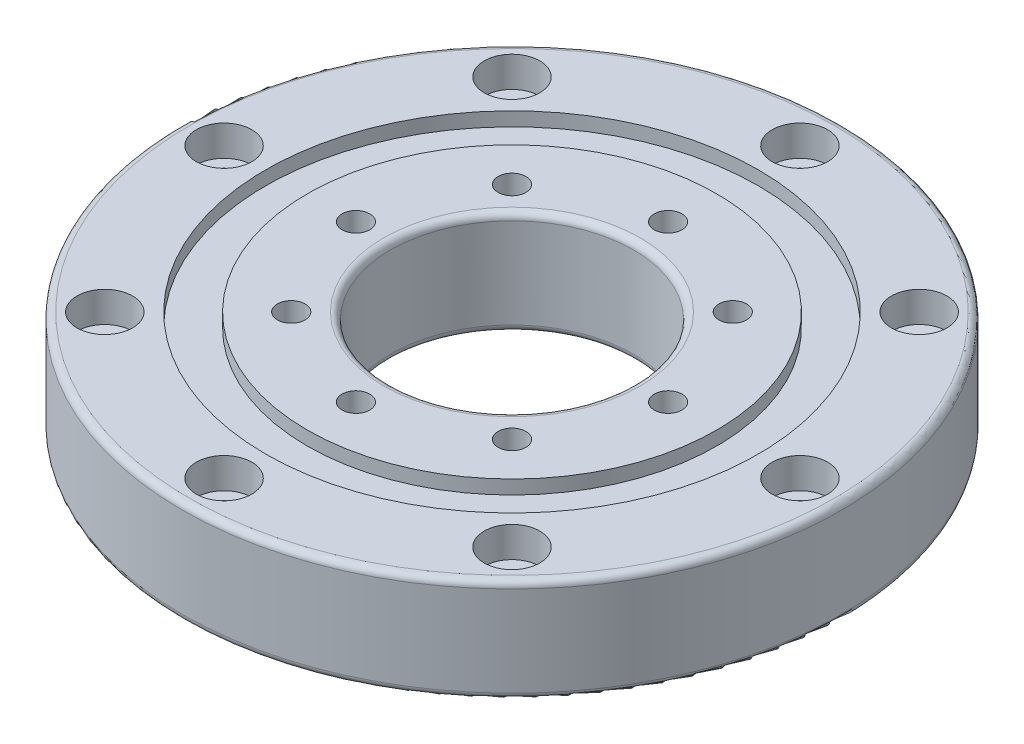
from build123d import *

# Parameters (mm, degrees)
CUT_EXTRUDE_1_DEPTH      = 69.82949949
CUT_EXTRUDE_1_DEPTH_BACK = 69.82949949
SKETCH_2_R               = 2
SKETCH_2_R_2             = 2.25
SKETCH_3_R               = 4
CUT_EXTRUDE_2_DEPTH      = 4.4
FILLET_1_R               = 1


with BuildPart() as part:
    # 草图1 → 旋转1 (revolve)
    with BuildSketch(Plane.XY, mode=Mode.PRIVATE) as revolve_1_sk:
        Polygon((17.5, 7.5), (17.5, -7.5), (29.5, -7.5), (29.5, -5.5), (35.5, -5.5), (35.5, -7.5), (47.5, -7.5), (47.5, 7.5), (35.5, 7.5), (35.5, 5.5), (29.5, 5.5), (29.5, 7.5), align=None)
    revolve(revolve_1_sk.sketch.rotate(Axis((0, 50.744480159, 0), (0, -1, 0)), 90), axis=Axis((0, 50.744480159, 0), (0, -1, 0)))

    # 草图2 → 切除-拉伸1 (cut, two sides: drawn at the far end of the back side and taken through both)
    with BuildSketch(Plane(origin=(0, 7.5, 0), x_dir=(1, 0, 0), z_dir=(0, 1, 0)).offset(-CUT_EXTRUDE_1_DEPTH_BACK)):
        with Locations(Location((0, 22.5, 0), (0, 0, 270))):
            Circle(SKETCH_2_R)
        with Locations(Location((0, 41.5, 0), (0, 0, 270))):
            Circle(SKETCH_2_R_2)
        with Locations(Location((15.909902577, 15.909902577, 0), (0, 0, 270))):
            Circle(SKETCH_2_R)
        with Locations(Location((22.5, 0, 0), (0, 0, 270))):
            Circle(SKETCH_2_R)
        with Locations(Location((15.909902577, -15.909902577, 0), (0, 0, 270))):
            Circle(SKETCH_2_R)
        with Locations(Location((0, -22.5, 0), (0, 0, 270))):
            Circle(SKETCH_2_R)
        with Locations(Location((-15.909902577, -15.909902577, 0), (0, 0, 270))):
            Circle(SKETCH_2_R)
        with Locations(Location((-22.5, 0, 0), (0, 0, 270))):
            Circle(SKETCH_2_R)
        with Locations(Location((-15.909902577, 15.909902577, 0), (0, 0, 270))):
            Circle(SKETCH_2_R)
        with Locations(Location((29.344931419, 29.344931419, 0), (0, 0, 270))):
            Circle(SKETCH_2_R_2)
        with Locations(Location((41.5, 0, 0), (0, 0, 270))):
            Circle(SKETCH_2_R_2)
        with Locations(Location((29.344931419, -29.344931419, 0), (0, 0, 270))):
            Circle(SKETCH_2_R_2)
        with Locations(Location((0, -41.5, 0), (0, 0, 270))):
            Circle(SKETCH_2_R_2)
        with Locations(Location((-29.344931419, -29.344931419, 0), (0, 0, 270))):
            Circle(SKETCH_2_R_2)
        with Locations(Location((-41.5, 0, 0), (0, 0, 270))):
            Circle(SKETCH_2_R_2)
        with Locations(Location((-29.344931419, 29.344931419, 0), (0, 0, 270))):
            Circle(SKETCH_2_R_2)
    extrude(amount=CUT_EXTRUDE_1_DEPTH + CUT_EXTRUDE_1_DEPTH_BACK, mode=Mode.SUBTRACT)

    # 草图3 → 切除-拉伸2 (cut)
    with BuildSketch(Plane(origin=(0, 7.5, 0), x_dir=(1, 0, 0), z_dir=(0, 1, 0))):
        with Locations(Location((0, 41.5, 0), (0, 0, 270))):
            Circle(SKETCH_3_R)
        with Locations(Location((29.344931419, 29.344931419, 0), (0, 0, 270))):
            Circle(SKETCH_3_R)
        with Locations(Location((41.5, 0, 0), (0, 0, 270))):
            Circle(SKETCH_3_R)
        with Locations(Location((29.344931419, -29.344931419, 0), (0, 0, 270))):
            Circle(SKETCH_3_R)
        with Locations(Location((0, -41.5, 0), (0, 0, 270))):
            Circle(SKETCH_3_R)
        with Locations(Location((-29.344931419, -29.344931419, 0), (0, 0, 270))):
            Circle(SKETCH_3_R)
        with Locations(Location((-41.5, 0, 0), (0, 0, 270))):
            Circle(SKETCH_3_R)
        with Locations(Location((-29.344931419, 29.344931419, 0), (0, 0, 270))):
            Circle(SKETCH_3_R)
    extrude(amount=-CUT_EXTRUDE_2_DEPTH, mode=Mode.SUBTRACT)

    # 圆角1
    fillet_1_edges = [part.edges().sort_by_distance(p)[0] for p in [
        (0, -7.5, -47.5),
        (0, 7.5, -47.5),
        (0, 7.5, -17.5),
        (0, -7.5, -17.5),
    ]]
    fillet(fillet_1_edges, radius=FILLET_1_R)


solid = part.part
